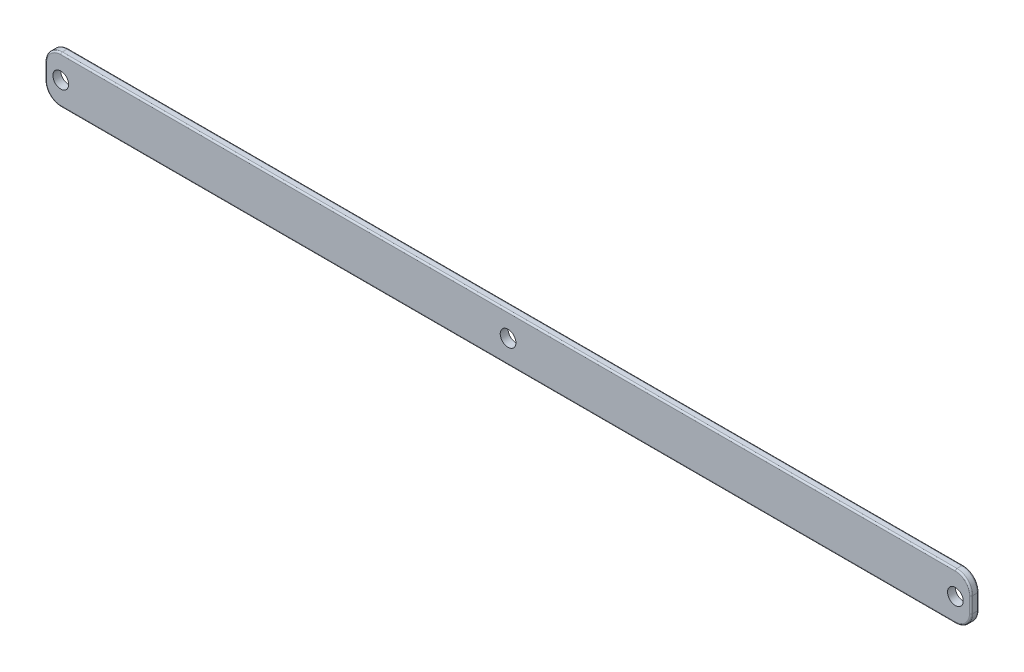
from build123d import *

# Parameters (mm, degrees)
SKETCH_1_W      = 590
SKETCH_1_H      = 30
SKETCH_1_R      = 5
EXTRUDE_1_DEPTH = 5
FILLET_1_R      = 10
FILLET_2_R      = 1


with BuildPart() as part:
    # 스케치1 → 보스-돌출1 (new body)
    with BuildSketch(Plane.XY):
        with Locations((5.677604278, 40.167322835)):
            Rectangle(SKETCH_1_W, SKETCH_1_H)
        with Locations((-279.322395722, 40.167322835)):
            Circle(SKETCH_1_R, mode=Mode.SUBTRACT)
        with Locations((290.677604278, 40.167322835)):
            Circle(SKETCH_1_R, mode=Mode.SUBTRACT)
        with Locations((5.677604278, 40.167322835)):
            Circle(SKETCH_1_R, mode=Mode.SUBTRACT)
    extrude(amount=EXTRUDE_1_DEPTH)

    # 필렛1
    fillet_1_edges = [part.edges().sort_by_distance(p)[0] for p in [
        (-289.322395722, 55.167322835, 2.5),
        (300.677604278, 55.167322835, 2.5),
        (300.677604278, 25.167322835, 2.5),
        (-289.322395722, 25.167322835, 2.5),
    ]]
    fillet(fillet_1_edges, radius=FILLET_1_R)

    # 필렛2
    fillet_2_edges = [part.edges().sort_by_distance(p)[0] for p in [
        (300.677604278, 40.167322835, 0),
        (300.677604278, 40.167322835, 5),
        (-289.322395722, 40.167322835, 0),
        (5.677604278, 55.167322835, 0),
        (5.677604278, 25.167322835, 0),
        (-286.393463534, 52.238390647, 0),
        (-286.393463534, 28.096255023, 0),
        (297.748672089, 52.238390647, 0),
        (297.748672089, 28.096255023, 0),
        (5.677604278, 25.167322835, 5),
        (-289.322395722, 40.167322835, 5),
        (5.677604278, 55.167322835, 5),
        (-286.393463534, 52.238390647, 5),
        (-286.393463534, 28.096255023, 5),
        (297.748672089, 52.238390647, 5),
        (297.748672089, 28.096255023, 5),
    ]]
    fillet(fillet_2_edges, radius=FILLET_2_R)


solid = part.part
